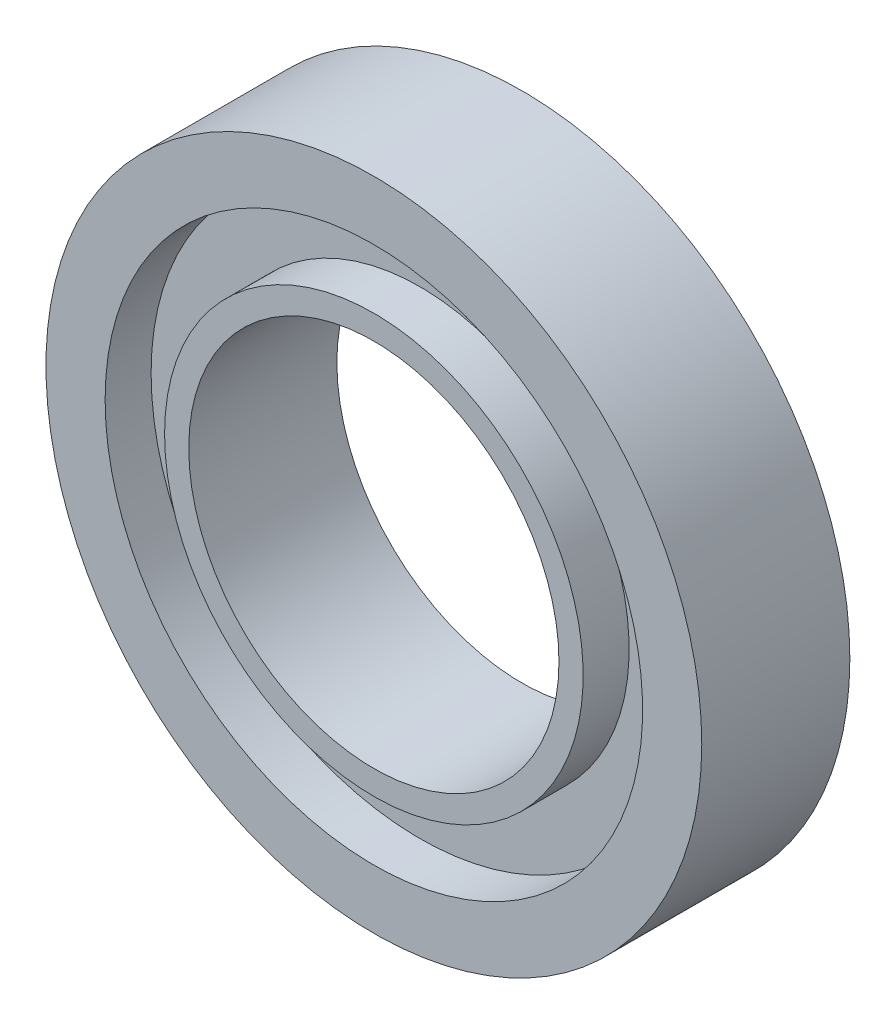
from build123d import *

# Parameters (mm, degrees)
SKETCH_1_R      = 31
SKETCH_1_R_2    = 17.5
EXTRUDE_1_DEPTH = 7
SKETCH_2_W      = 5.621005066
SKETCH_2_H      = 4.346885609


with BuildPart() as part:
    # 草图1 → 凸台-拉伸1 (new, symmetric)
    with BuildSketch(Plane.XY):
        Circle(SKETCH_1_R)
        Circle(SKETCH_1_R_2, mode=Mode.SUBTRACT)
    extrude(amount=EXTRUDE_1_DEPTH, both=True)

    # 草图2 → 切除-旋转1 (revolve, cut)
    with BuildSketch(Plane(origin=(0, 0, 0), x_dir=(1, 0, 0), z_dir=(0, 1, 0)), mode=Mode.PRIVATE) as cut_revolve_1_sk:
        with Locations((22.596440368, 4.826557196)):
            Rectangle(SKETCH_2_W, SKETCH_2_H)
    cut_revolve_1 = revolve(cut_revolve_1_sk.sketch.rotate(Axis((0, 0, -7), (0, 0, 1)), 180), axis=Axis((0, 0, -7), (0, 0, 1)), mode=Mode.SUBTRACT)

    # 镜向1: 切除-旋转1 across plane
    add(cut_revolve_1.mirror(Plane.XY), mode=Mode.SUBTRACT)


solid = part.part
